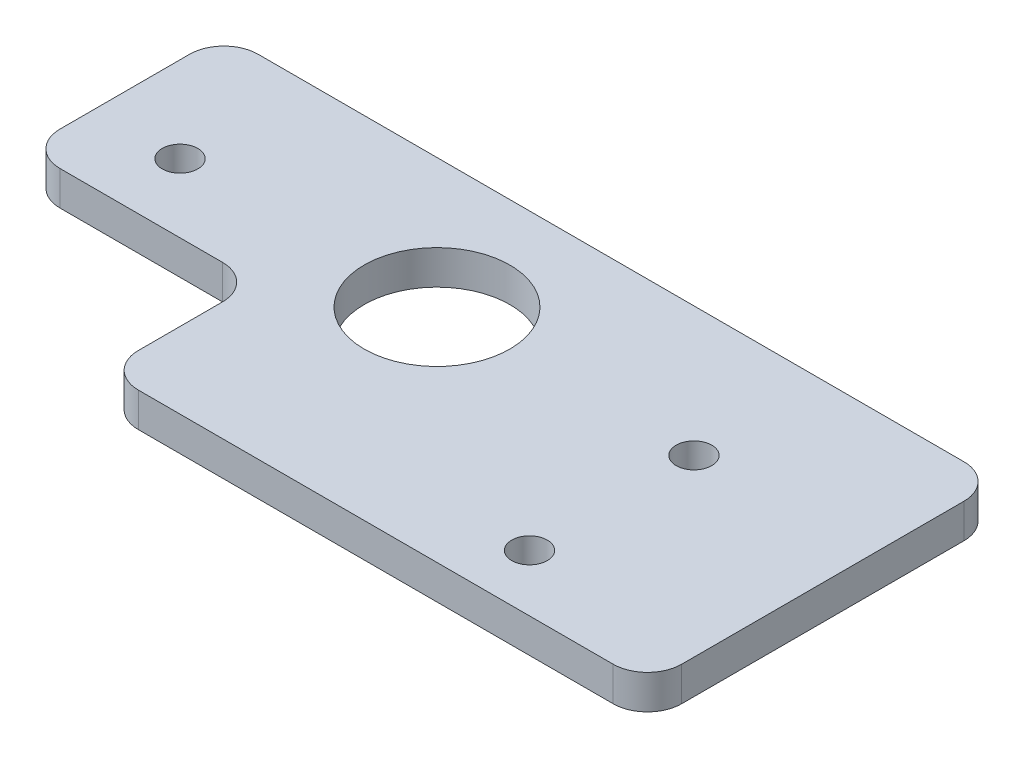
from build123d import *

# Parameters (mm, degrees)
SKETCH1_W             = 71.75
SKETCH1_H             = 32.5
BOSS_EXTRUDE1_DEPTH   = 3.175
M4X0_7_TAPPED_HOLE1_D = 3.3
SKETCH5_R             = 6.75
CUT_EXTRUDE1_DEPTH    = 79.831422193
SKETCH6_W             = 21.4
SKETCH6_H             = 14.15
CUT_EXTRUDE2_DEPTH    = 79.831422193
FILLET1_R             = 3.175


with BuildPart() as part:
    # Sketch1 → Boss-Extrude1 (new body)
    with BuildSketch(Plane(origin=(0, 0, 0), x_dir=(1, 0, 0), z_dir=(0, 1, 0))):
        with Locations((35.875, 16.25)):
            Rectangle(SKETCH1_W, SKETCH1_H)
    extrude(amount=BOSS_EXTRUDE1_DEPTH)

    # M4x0.7 Tapped Hole1 (through all)
    with Locations(Plane(origin=(0, 3.175, 0), x_dir=(1, 0, 0), z_dir=(0, 1, 0))):
        with Locations((7.9375, 20.5), (55.5625, 20.5), (55.5625, 5.26)):
            Hole(M4X0_7_TAPPED_HOLE1_D / 2)

    # Sketch5 → Cut-Extrude1 (cut, through all)
    with BuildSketch(Plane(origin=(0, 3.175, 0), x_dir=(1, 0, 0), z_dir=(0, 1, 0))):
        with Locations((31.75, 20.5)):
            Circle(SKETCH5_R)
    extrude(amount=-CUT_EXTRUDE1_DEPTH, mode=Mode.SUBTRACT)

    # Sketch6 → Cut-Extrude2 (cut, through all)
    with BuildSketch(Plane(origin=(0, 3.175, 0), x_dir=(1, 0, 0), z_dir=(0, 1, 0))):
        with Locations((10.7, 7.075)):
            Rectangle(SKETCH6_W, SKETCH6_H)
    extrude(amount=-CUT_EXTRUDE2_DEPTH, mode=Mode.SUBTRACT)

    # Fillet1
    fillet1_edges = [part.edges().sort_by_distance(p)[0] for p in [
        (0, 1.5875, -32.5),
        (71.75, 1.5875, -32.5),
        (71.75, 1.5875, 0),
        (0, 1.5875, -14.15),
        (21.4, 1.5875, -14.15),
        (21.4, 1.5875, 0),
    ]]
    fillet(fillet1_edges, radius=FILLET1_R)


solid = part.part
